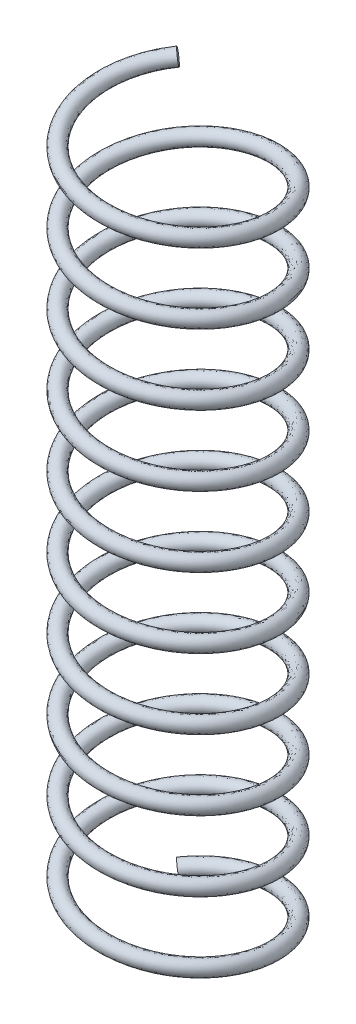
from build123d import *

# Parameters (mm, degrees)
SWEEP1_PITCH       = 7
SWEEP1_HEIGHT      = 70
SWEEP1_RADIUS      = 8.5
SWEEP1_START_ANGLE = -135
SWEEP1_PROFILE_R   = 0.75


with BuildPart() as part:
    # Sweep1: sweep along a helix
    with BuildLine() as sweep1_path:
        add(Helix(SWEEP1_PITCH, SWEEP1_HEIGHT, SWEEP1_RADIUS, center=(0, 0, 0), direction=(0, 1, 0), lefthand=True, mode=Mode.PRIVATE).rotate(Axis((0, 0, 0), (0, 1, 0)), SWEEP1_START_ANGLE))
    # Sweep1 profile (on start of the path) → Sweep1 (sweep)
    with BuildSketch(Plane(origin=(-6.01040764, 0, -6.01040764), x_dir=(0.7071067811865034, 0, 0.7071067811865915), z_dir=(0.7011102304298961, 0.12995726056361323, -0.7011102304298087))):
        Circle(SWEEP1_PROFILE_R)
    sweep(path=sweep1_path.line, is_frenet=True)


solid = part.part
